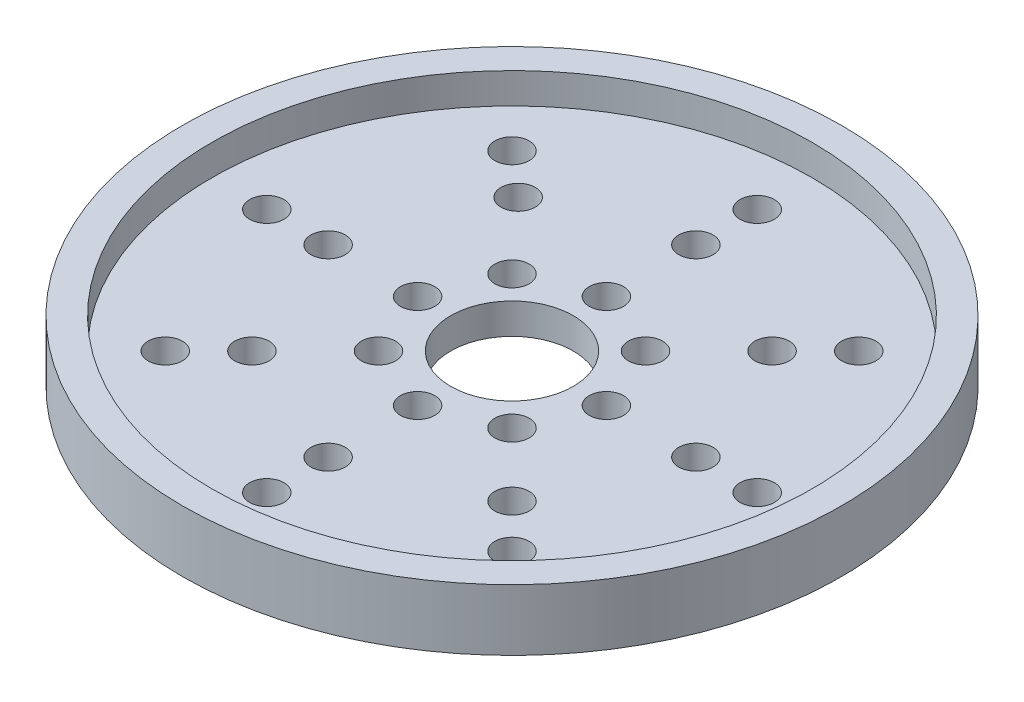
from build123d import *

# Parameters (mm, degrees)
SKETCH1_R           = 34.1376
BOSS_EXTRUDE1_DEPTH = 6.35
SKETCH2_R           = 31.0896
CUT_EXTRUDE3_DEPTH  = 3.175
SKETCH3_R           = 6.35
CUT_EXTRUDE4_DEPTH  = 3.175
SKETCH3_3_R         = 6.35
SKETCH3_3_R_2       = 1.778
CUT_EXTRUDE5_DEPTH  = 3.175
SKETCH6_R           = 1.778
CUT_EXTRUDE6_DEPTH  = 3.175
SKETCH8_R           = 1.778
CUT_EXTRUDE7_DEPTH  = 3.175


with BuildPart() as part:
    # Sketch1 → Boss-Extrude1 (new body)
    with BuildSketch(Plane(origin=(0, 0, 0), x_dir=(1, 0, 0), z_dir=(0, 1, 0))):
        Circle(SKETCH1_R)
    extrude(amount=BOSS_EXTRUDE1_DEPTH)

    # Sketch2 → Cut-Extrude3 (cut)
    with BuildSketch(Plane(origin=(0, 6.35, 0), x_dir=(1, 0, 0), z_dir=(0, 1, 0))):
        Circle(SKETCH2_R)
    extrude(amount=-CUT_EXTRUDE3_DEPTH, mode=Mode.SUBTRACT)

    # Sketch3 → Cut-Extrude4 (cut)
    with BuildSketch(Plane(origin=(0, 3.175, 0), x_dir=(1, 0, 0), z_dir=(0, 1, 0))):
        Circle(SKETCH3_R)
    extrude(amount=-CUT_EXTRUDE4_DEPTH, mode=Mode.SUBTRACT)

    # Sketch3<3> → Cut-Extrude5 (cut)
    with BuildSketch(Plane(origin=(0, 3.175, 0), x_dir=(1, 0, 0), z_dir=(0, 1, 0))):
        Circle(SKETCH3_3_R)
        with Locations((25.4, 0)):
            Circle(SKETCH3_3_R_2)
        with Locations((17.960512242, 17.960512242)):
            Circle(SKETCH3_3_R_2)
        with Locations((0, 25.4)):
            Circle(SKETCH3_3_R_2)
        with Locations((-17.960512242, 17.960512242)):
            Circle(SKETCH3_3_R_2)
        with Locations((-25.4, 0)):
            Circle(SKETCH3_3_R_2)
        with Locations((-17.960512242, -17.960512242)):
            Circle(SKETCH3_3_R_2)
        with Locations((0, -25.4)):
            Circle(SKETCH3_3_R_2)
        with Locations((17.960512242, -17.960512242)):
            Circle(SKETCH3_3_R_2)
    extrude(amount=-CUT_EXTRUDE5_DEPTH, mode=Mode.SUBTRACT)

    # Sketch6 → Cut-Extrude6 (cut)
    with BuildSketch(Plane(origin=(0, 3.175, 0), x_dir=(1, 0, 0), z_dir=(0, 1, 0))):
        with Locations((0, 19.05)):
            Circle(SKETCH6_R)
        with Locations((-13.470384182, 14.10896611)):
            Circle(SKETCH6_R)
        with Locations((-19.05, 0)):
            Circle(SKETCH6_R)
        with Locations((-13.470384182, -13.470384182)):
            Circle(SKETCH6_R)
        with Locations((0, -19.05)):
            Circle(SKETCH6_R)
        with Locations((13.470384182, -13.470384182)):
            Circle(SKETCH6_R)
        with Locations((19.05, 0)):
            Circle(SKETCH6_R)
        with Locations((13.470384182, 13.470384182)):
            Circle(SKETCH6_R)
    extrude(amount=-CUT_EXTRUDE6_DEPTH, mode=Mode.SUBTRACT)

    # Sketch8 → Cut-Extrude7 (cut)
    with BuildSketch(Plane(origin=(0, 3.175, 0), x_dir=(1, 0, 0), z_dir=(0, 1, 0))):
        with Locations((9.779, 0)):
            Circle(SKETCH8_R)
        with Locations((6.914797213, 6.914797213)):
            Circle(SKETCH8_R)
        with Locations((0, 9.779)):
            Circle(SKETCH8_R)
        with Locations((-6.914797213, 6.914797213)):
            Circle(SKETCH8_R)
        with Locations((-9.779, 0)):
            Circle(SKETCH8_R)
        with Locations((-6.914797213, -6.914797213)):
            Circle(SKETCH8_R)
        with Locations((0, -9.779)):
            Circle(SKETCH8_R)
        with Locations((6.914797213, -6.914797213)):
            Circle(SKETCH8_R)
    extrude(amount=-CUT_EXTRUDE7_DEPTH, mode=Mode.SUBTRACT)


solid = part.part
